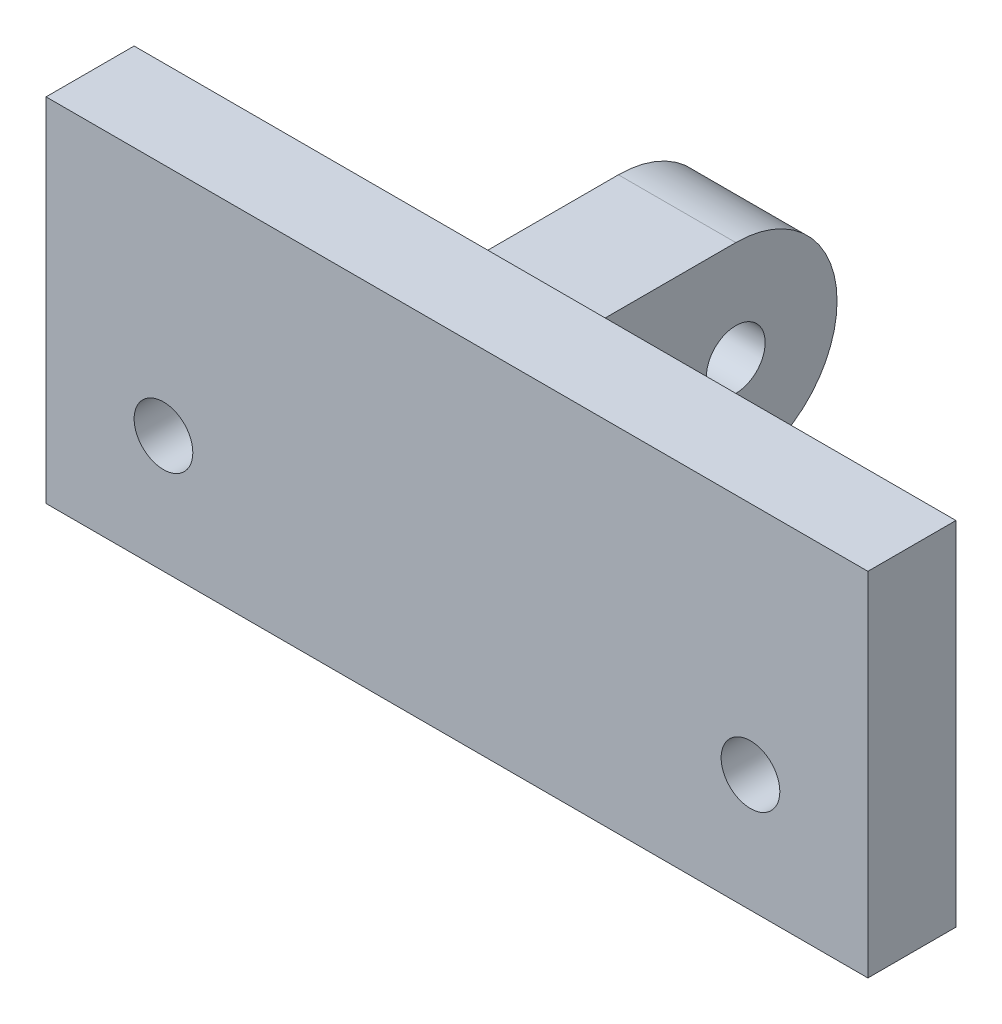
from build123d import *

# Parameters (mm, degrees)
CROQUIS1_W              = 28
CROQUIS1_H              = 12
SALIENTE_EXTRUIR1_DEPTH = 3
CROQUIS2_R              = 1
CORTAR_EXTRUIR1_DEPTH   = 3
CROQUIS3_W              = 3
CROQUIS3_H              = 8.392153605
SALIENTE_EXTRUIR2_DEPTH = 8
CROQUIS4_R              = 1
CORTAR_EXTRUIR2_DEPTH   = 3
CORTAR_EXTRUIR3_DEPTH   = 8
SALIENTE_EXTRUIR4_START = 0.5
CROQUIS11_R             = 1
SALIENTE_EXTRUIR4_DEPTH = 0.5
CROQUIS12_R             = 1
SALIENTE_EXTRUIR5_DEPTH = 0.5


with BuildPart() as part:
    # Croquis1 → Saliente-Extruir1 (new body)
    with BuildSketch(Plane.XY):
        with Locations((-16.412225504, 7.356643357)):
            Rectangle(CROQUIS1_W, CROQUIS1_H)
    extrude(amount=SALIENTE_EXTRUIR1_DEPTH)

    # Croquis2 → Cortar-Extruir1 (cut)
    with BuildSketch(Plane.XY.offset(3)):
        with Locations((-26.412225504, 5.356643357)):
            Circle(CROQUIS2_R)
        with Locations((-6.412225504, 5.356643357)):
            Circle(CROQUIS2_R)
    extrude(amount=-CORTAR_EXTRUIR1_DEPTH, mode=Mode.SUBTRACT)

    # Croquis3 → Saliente-Extruir2 (add)
    with BuildSketch(Plane(origin=(0, 0, 0), x_dir=(-1, 0, 0), z_dir=(0, 0, -1))):
        with Locations((16.412225504, 9.160566555)):
            Rectangle(CROQUIS3_W, CROQUIS3_H)
    extrude(amount=SALIENTE_EXTRUIR2_DEPTH)

    # Croquis4 → Cortar-Extruir2 (cut)
    with BuildSketch(Plane.ZY.offset(17.912225504)):
        with Locations((-4.5, 9.856643357)):
            Circle(CROQUIS4_R)
    extrude(amount=-CORTAR_EXTRUIR2_DEPTH, mode=Mode.SUBTRACT)

    # Croquis6 → Cortar-Extruir3 (cut)
    with BuildSketch(Plane.ZY.offset(17.912225504)):
        with BuildLine():
            Line((-8, 13.356643357), (-4.5, 13.356643357))
            Line((-4.5, 13.356643357), (0, 13.356643357))
            Line((0, 13.356643357), (0, 13.306643357))
            Line((0, 13.306643357), (-4.5, 13.306643357))
            ThreePointArc((-4.5, 13.306643357), (-7.95, 9.856643357), (-4.5, 6.406643357))
            Line((-4.5, 6.406643357), (0, 6.406643357))
            Line((0, 6.406643357), (0, 4.964489752))
            Line((0, 4.964489752), (-8, 4.964489752))
            Line((-8, 4.964489752), (-8, 6.352103478))
            Line((-8, 6.352103478), (-8, 13.356643357))
        make_face()
    extrude(amount=-CORTAR_EXTRUIR3_DEPTH, mode=Mode.SUBTRACT)

    # Croquis11 → Saliente-Extruir4 (add)
    with BuildSketch(Plane.ZY.offset(17.912225504).offset(SALIENTE_EXTRUIR4_START)):
        with BuildLine():
            Line((-4.5, 6.406643357), (0, 6.406643357))
            Line((0, 6.406643357), (0, 13.306643357))
            Line((0, 13.306643357), (-4.5, 13.306643357))
            ThreePointArc((-4.5, 13.306643357), (-7.95, 9.856643357), (-4.5, 6.406643357))
        make_face()
        with Locations((-4.5, 9.856643357)):
            Circle(CROQUIS11_R, mode=Mode.SUBTRACT)
    extrude(amount=-SALIENTE_EXTRUIR4_DEPTH)

    # Croquis12 → Saliente-Extruir5 (add)
    with BuildSketch(Plane(origin=(-14.912225504, 0, 0), x_dir=(0, 0, -1), z_dir=(1, 0, 0))):
        with BuildLine():
            Line((4.5, 13.306643357), (0, 13.306643357))
            Line((0, 13.306643357), (0, 6.406643357))
            Line((0, 6.406643357), (4.5, 6.406643357))
            ThreePointArc((4.5, 6.406643357), (7.95, 9.856643357), (4.5, 13.306643357))
        make_face()
        with Locations(Location((4.5, 9.856643357, 0), (0, 0, 180))):
            Circle(CROQUIS12_R, mode=Mode.SUBTRACT)
    extrude(amount=SALIENTE_EXTRUIR5_DEPTH)


solid = part.part
